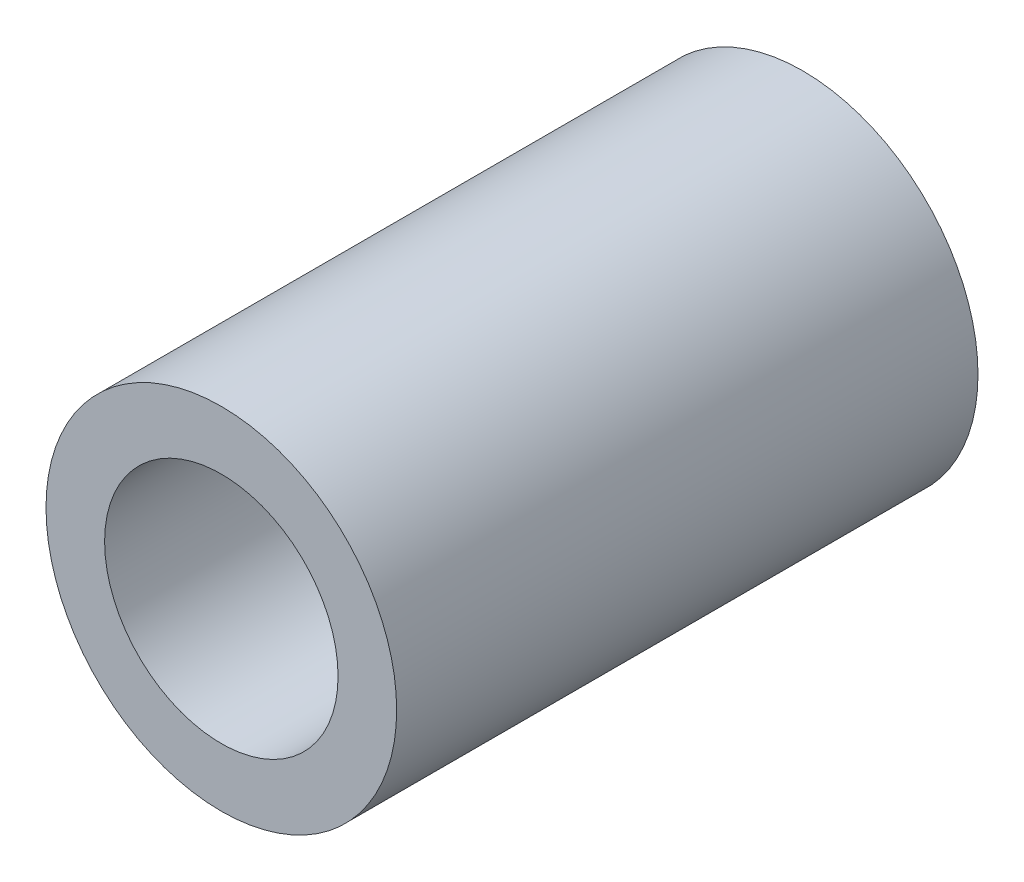
from build123d import *

# Parameters (mm, degrees)
SKETCH1_R      = 4.7879
SKETCH1_R_2    = 3.1877
EXTRUDE1_DEPTH = 7.9375


with BuildPart() as part:
    # Sketch1 → Extrude1 (new, symmetric)
    with BuildSketch(Plane.XY):
        Circle(SKETCH1_R)
        Circle(SKETCH1_R_2, mode=Mode.SUBTRACT)
    extrude(amount=EXTRUDE1_DEPTH, both=True)


solid = part.part
